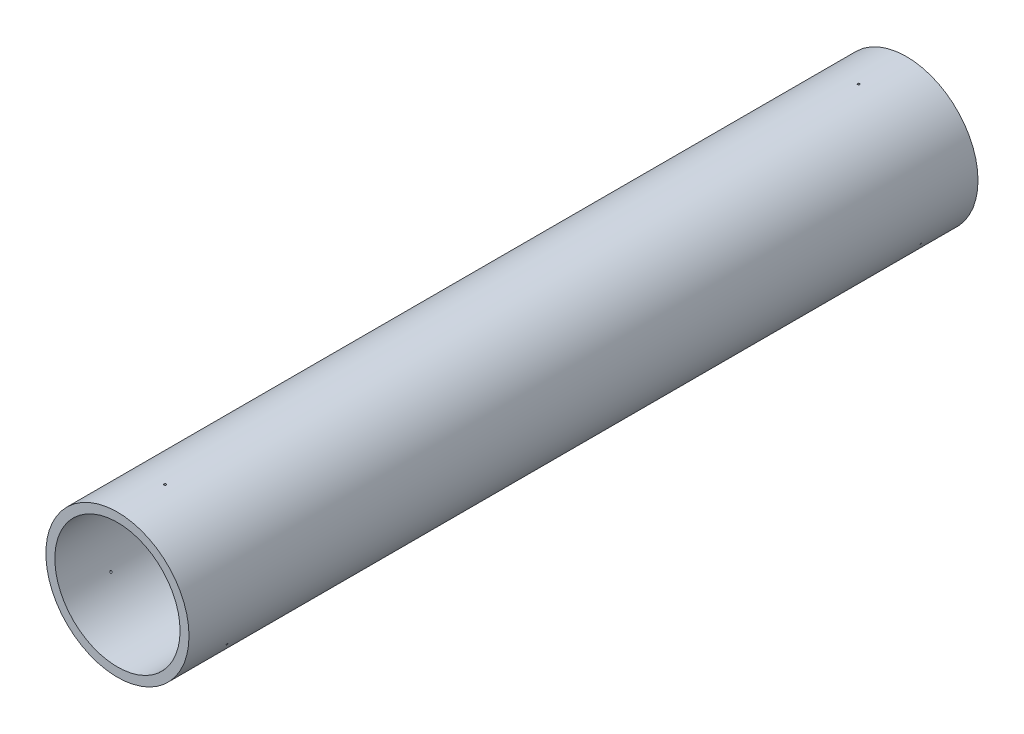
from build123d import *

# Parameters (mm, degrees)
SKETCH1_R                  = 76.1746
SKETCH1_R_2                = 66.6496
BOSS_EXTRUDE1_DEPTH        = 419.8874
F_4_40_TAPPED_HOLE1_REACH  = 809.152
F_4_40_TAPPED_HOLE1_BORE_R = 1.1303
CIRPATTERN1_COUNT          = 3
MIRROR1_COPY_1_REACH       = 809.152
MIRROR1_COPY_1_SKETCH_R    = 1.1303
MIRROR1_COPY_2_REACH       = 809.152
MIRROR1_COPY_2_SKETCH_R    = 1.1303


with BuildPart() as part:
    # Sketch1 → Boss-Extrude1 (new, symmetric)
    with BuildSketch(Plane.XY):
        Circle(SKETCH1_R)
        Circle(SKETCH1_R_2, mode=Mode.SUBTRACT)
    extrude(amount=BOSS_EXTRUDE1_DEPTH, both=True)

    # #4-40 Tapped Hole1 bore (on position points) → #4-40 Tapped Hole1 (cut, up to next)
    with BuildSketch(Plane(origin=(0, 76.1746, 369.0874), x_dir=(1, 0, 0), z_dir=(0, 1, 0)), mode=Mode.PRIVATE) as f_4_40_tapped_hole1_sk1:
        Circle(F_4_40_TAPPED_HOLE1_BORE_R)
    f_4_40_tapped_hole1_tool1 = extrude(f_4_40_tapped_hole1_sk1.sketch, amount=-F_4_40_TAPPED_HOLE1_REACH, mode=Mode.PRIVATE) & part.part
    f_4_40_tapped_hole1 = f_4_40_tapped_hole1_tool1.solids().sort_by_distance((0, 76.1746, 369.0874))[0]
    add(f_4_40_tapped_hole1, mode=Mode.SUBTRACT)

    # CirPattern1: #4-40 Tapped Hole1 ×3 about axis
    cirpattern1_axis = Axis((0, 0, 419.8874), (0, 0, 1))
    for i in range(1, CIRPATTERN1_COUNT):
        add(f_4_40_tapped_hole1.rotate(cirpattern1_axis, i * 360 / CIRPATTERN1_COUNT), mode=Mode.SUBTRACT)

    # Mirror1: #4-40 Tapped Hole1 across plane
    add(f_4_40_tapped_hole1.mirror(Plane.XY), mode=Mode.SUBTRACT)

    # Mirror1 copy 1 sketch → Mirror1 copy 1 (cut, up to next)
    with BuildSketch(Plane(origin=(-65.969138723, -38.0873, -369.0874), x_dir=(-0.4999999999999998, 0.8660254037844387, 0), z_dir=(-0.8660254037844387, -0.4999999999999998, 0)), mode=Mode.PRIVATE) as mirror1_copy_1_sk1:
        Circle(MIRROR1_COPY_1_SKETCH_R)
    mirror1_copy_1_tool1 = extrude(mirror1_copy_1_sk1.sketch, amount=-MIRROR1_COPY_1_REACH, mode=Mode.PRIVATE) & part.part
    add(mirror1_copy_1_tool1.solids().sort_by_distance((-65.969138723, -38.0873, -369.0874))[0], mode=Mode.SUBTRACT)

    # Mirror1 copy 2 sketch → Mirror1 copy 2 (cut, up to next)
    with BuildSketch(Plane(origin=(65.969138723, -38.0873, -369.0874), x_dir=(-0.5000000000000004, -0.8660254037844384, 0), z_dir=(0.8660254037844384, -0.5000000000000004, 0)), mode=Mode.PRIVATE) as mirror1_copy_2_sk1:
        Circle(MIRROR1_COPY_2_SKETCH_R)
    mirror1_copy_2_tool1 = extrude(mirror1_copy_2_sk1.sketch, amount=-MIRROR1_COPY_2_REACH, mode=Mode.PRIVATE) & part.part
    add(mirror1_copy_2_tool1.solids().sort_by_distance((65.969138723, -38.0873, -369.0874))[0], mode=Mode.SUBTRACT)


solid = part.part
